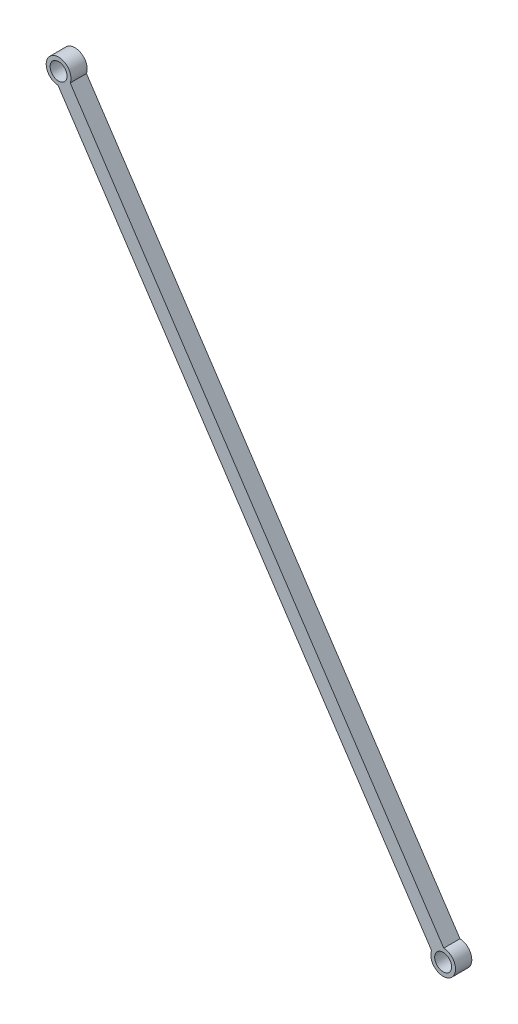
from build123d import *

# Parameters (mm, degrees)
SKETCH1_R           = 0.65
BOSS_EXTRUDE1_DEPTH = 1.25


with BuildPart() as part:
    # Sketch1 → Boss-Extrude1 (new body)
    with BuildSketch(Plane.XY):
        with BuildLine():
            Line((-7.043649386, -2.912116644), (-35.735240036, 40.296171563))
            ThreePointArc((-35.735240036, 40.296171563), (-36.21599314, 42.036525841), (-34.798495879, 40.918197592))
            Line((-34.798495879, 40.918197592), (-6.106905228, -2.290090616))
            ThreePointArc((-6.106905228, -2.290090616), (-5.626152124, -4.030444894), (-7.043649386, -2.912116644))
        make_face()
        with Locations((-6.15167169, -3.239035274)):
            Circle(SKETCH1_R, mode=Mode.SUBTRACT)
        with Locations((-35.690473574, 41.245116221)):
            Circle(SKETCH1_R, mode=Mode.SUBTRACT)
    extrude(amount=BOSS_EXTRUDE1_DEPTH)


solid = part.part
